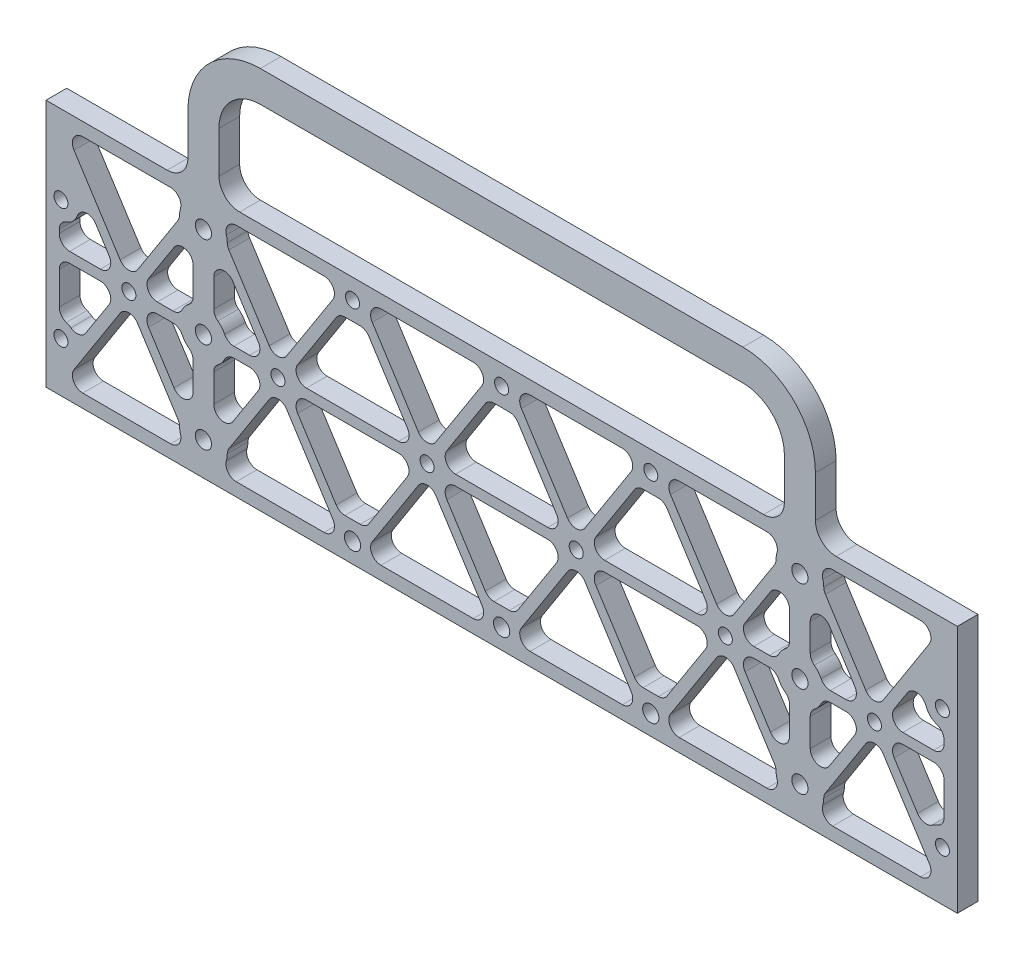
from build123d import *

# Parameters (mm, degrees)
SKETCH1_W              = 279.4
SKETCH1_H              = 76.2
BOSS_EXTRUDE1_DEPTH    = 6.35
F_10_CLEARANCE_HOLE1_D = 4.9784
SKETCH5_W              = 9.525
SKETCH5_H              = 31.75
BOSS_EXTRUDE2_DEPTH    = 6.35
FILLET1_R              = 12.7
FILLET1_OF_MIRROR1_R   = 12.7
FILLET2_R              = 6.35
FILLET3_R              = 6.35
F_8_CLEARANCE_HOLE1_D  = 4.3053
CUT_EXTRUDE1_DEPTH     = 161.800507229
FILLET4_R              = 3.175
FILLET5_R              = 3.175
SKETCH10_R             = 2.15265
SKETCH10_R_2           = 2.4892
CUT_EXTRUDE2_DEPTH     = 161.800507229
FILLET6_R              = 22.225


with BuildPart() as part:
    # Sketch1 → Boss-Extrude1 (new body)
    with BuildSketch(Plane.XY):
        Rectangle(SKETCH1_W, SKETCH1_H)
    extrude(amount=BOSS_EXTRUDE1_DEPTH)

    # #10 Clearance Hole1 (through all)
    with Locations(Plane.XY.offset(6.35)):
        with Locations((-91.44, 27.94), (-91.44, -27.94), (91.44, 27.94), (91.44, -27.94), (-91.44, 0), (91.44, 0)):
            Hole(F_10_CLEARANCE_HOLE1_D / 2)

    # Sketch5 → Boss-Extrude2 (add)
    with BuildSketch(Plane.XY.offset(6.35)):
        with Locations((-91.44, 53.975)):
            Rectangle(SKETCH5_W, SKETCH5_H)
        Polygon((-96.2025, 79.375), (-96.2025, 69.85), (-86.6775, 69.85), (0, 69.85), (0, 79.375), align=None)
    boss_extrude2 = extrude(amount=-BOSS_EXTRUDE2_DEPTH)

    # Fillet1
    fillet1_edges = [part.edges().sort_by_distance(p)[0] for p in [
        (-86.6775, 69.85, 3.175),
    ]]
    fillet(fillet1_edges, radius=FILLET1_R)

    # Mirror1: Boss-Extrude2 across plane
    add(boss_extrude2.mirror(Plane(origin=(0, 0, 0), x_dir=(0, 0, 1), z_dir=(1, 0, 0))))

    # Fillet1 of Mirror1
    fillet1_of_mirror1_edges = [part.edges().sort_by_distance(p)[0] for p in [
        (86.6775, 69.85, 3.175),
    ]]
    fillet(fillet1_of_mirror1_edges, radius=FILLET1_OF_MIRROR1_R)

    # Fillet2
    fillet2_edges = [part.edges().sort_by_distance(p)[0] for p in [
        (-86.6775, 38.1, 3.175),
        (86.6775, 38.1, 3.175),
    ]]
    fillet(fillet2_edges, radius=FILLET2_R)

    # Fillet3
    fillet3_edges = [part.edges().sort_by_distance(p)[0] for p in [
        (-96.2025, 38.1, 3.175),
        (96.2025, 38.1, 3.175),
    ]]
    fillet(fillet3_edges, radius=FILLET3_R)

    # #8 Clearance Hole1 (through all)
    with Locations(Plane.XY.offset(6.35)):
        with Locations((-135.128, 13.97), (-135.128, -22.86), (135.128, 13.97), (135.128, -22.86)):
            Hole(F_8_CLEARANCE_HOLE1_D / 2)

    # Sketch9 → Cut-Extrude1 (cut, through all)
    with BuildSketch(Plane.XY.offset(6.35)):
        with BuildLine():
            Line((-117.204966751, -1.5875), (-135.636, -1.5875))
            Line((-135.636, -1.5875), (-135.636, -17.55662461))
            ThreePointArc((-135.636, -17.55662461), (-132.085038618, -18.486872909), (-129.978664585, -21.493179125))
            Line((-129.978664585, -21.493179125), (-117.204966751, -1.5875))
        make_face()
        with BuildLine():
            Line((-135.636, 8.66662461), (-135.636, 1.5875))
            Line((-135.636, 1.5875), (-117.204966751, 1.5875))
            Line((-117.204966751, 1.5875), (-124.437036119, 12.857474766))
            ThreePointArc((-124.437036119, 12.857474766), (-127.475945101, 14.296480554), (-130.10350516, 12.198473503))
            ThreePointArc((-130.10350516, 12.198473503), (-132.261264826, 9.479378221), (-135.636, 8.66662461))
        make_face()
        with BuildLine():
            ThreePointArc((-98.719572426, 27.218906156), (-98.048472928, 31.076915141), (-95.483628944, 34.036))
            Line((-95.483628944, 34.036), (-128.445099748, 34.036))
            ThreePointArc((-128.445099748, 34.036), (-131.23121879, 32.383552359), (-131.117233367, 29.146261849))
            Line((-131.117233367, 29.146261849), (-114.3, 2.93940652))
            Line((-114.3, 2.93940652), (-98.719572426, 27.218906156))
        make_face()
        with BuildLine():
            Line((-48.624966751, 34.036), (-87.396371056, 34.036))
            ThreePointArc((-87.396371056, 34.036), (-84.831527072, 31.076915141), (-84.160427574, 27.218906156))
            Line((-84.160427574, 27.218906156), (-68.58, 2.93940652))
            Line((-68.58, 2.93940652), (-48.624966751, 34.036))
        make_face()
        with BuildLine():
            ThreePointArc((-94.615, 16.909863774), (-96.89652343, 19.95655454), (-100.462133618, 18.624601925))
            Line((-100.462133618, 18.624601925), (-111.395033249, 1.5875))
            Line((-111.395033249, 1.5875), (-98.58086793, 1.5875))
            ThreePointArc((-98.58086793, 1.5875), (-97.172467578, 4.54433345), (-94.615, 6.590259937))
            Line((-94.615, 6.590259937), (-94.615, 16.909863774))
        make_face()
        with BuildLine():
            ThreePointArc((-82.417866382, 18.624601925), (-85.98347657, 19.95655454), (-88.265, 16.909863774))
            Line((-88.265, 16.909863774), (-88.265, 6.590259937))
            ThreePointArc((-88.265, 6.590259937), (-85.707532422, 4.54433345), (-84.29913207, 1.5875))
            Line((-84.29913207, 1.5875), (-71.484966751, 1.5875))
            Line((-71.484966751, 1.5875), (-82.417866382, 18.624601925))
        make_face()
        with BuildLine():
            ThreePointArc((-94.615, -6.590259937), (-97.172467578, -4.54433345), (-98.58086793, -1.5875))
            Line((-98.58086793, -1.5875), (-111.395033249, -1.5875))
            Line((-111.395033249, -1.5875), (-100.462133618, -18.624601925))
            ThreePointArc((-100.462133618, -18.624601925), (-96.89652343, -19.95655454), (-94.615, -16.909863774))
            Line((-94.615, -16.909863774), (-94.615, -6.590259937))
        make_face()
        with BuildLine():
            ThreePointArc((-84.29913207, -1.5875), (-85.707532422, -4.54433345), (-88.265, -6.590259937))
            Line((-88.265, -6.590259937), (-88.265, -16.909863774))
            ThreePointArc((-88.265, -16.909863774), (-85.98347657, -19.95655454), (-82.417866382, -18.624601925))
            Line((-82.417866382, -18.624601925), (-71.484966751, -1.5875))
            Line((-71.484966751, -1.5875), (-84.29913207, -1.5875))
        make_face()
        with BuildLine():
            ThreePointArc((-95.483628944, -34.036), (-98.048472928, -31.076915141), (-98.719572426, -27.218906156))
            Line((-98.719572426, -27.218906156), (-114.3, -2.93940652))
            Line((-114.3, -2.93940652), (-131.117233367, -29.146261849))
            ThreePointArc((-131.117233367, -29.146261849), (-131.23121879, -32.383552359), (-128.445099748, -34.036))
            Line((-128.445099748, -34.036), (-95.483628944, -34.036))
        make_face()
        with BuildLine():
            ThreePointArc((-84.160427574, -27.218906156), (-84.831527072, -31.076915141), (-87.396371056, -34.036))
            Line((-87.396371056, -34.036), (-48.624966751, -34.036))
            Line((-48.624966751, -34.036), (-68.58, -2.93940652))
            Line((-68.58, -2.93940652), (-84.160427574, -27.218906156))
        make_face()
        Polygon((-41.648795628, 26.3398), (-49.791204372, 26.3398), (-65.675033249, 1.5875), (-25.764966751, 1.5875), align=None)
        Polygon((-22.86, 2.93940652), (-2.904966751, 34.036), (-42.815033249, 34.036), align=None)
        Polygon((4.071204372, 26.3398), (-4.071204372, 26.3398), (-19.955033249, 1.5875), (19.955033249, 1.5875), align=None)
        Polygon((22.86, 2.93940652), (42.815033249, 34.036), (2.904966751, 34.036), align=None)
        Polygon((49.791204372, 26.3398), (41.648795628, 26.3398), (25.764966751, 1.5875), (65.675033249, 1.5875), align=None)
        with BuildLine():
            ThreePointArc((84.160427574, 27.218906156), (84.831527072, 31.076915141), (87.396371056, 34.036))
            Line((87.396371056, 34.036), (48.624966751, 34.036))
            Line((48.624966751, 34.036), (68.58, 2.93940652))
            Line((68.58, 2.93940652), (84.160427574, 27.218906156))
        make_face()
        with BuildLine():
            Line((128.445099748, 34.036), (95.483628944, 34.036))
            ThreePointArc((95.483628944, 34.036), (98.048472928, 31.076915141), (98.719572426, 27.218906156))
            Line((98.719572426, 27.218906156), (114.3, 2.93940652))
            Line((114.3, 2.93940652), (131.117233367, 29.146261849))
            ThreePointArc((131.117233367, 29.146261849), (131.23121879, 32.383552359), (128.445099748, 34.036))
        make_face()
        with BuildLine():
            ThreePointArc((88.265, 16.909863774), (85.98347657, 19.95655454), (82.417866382, 18.624601925))
            Line((82.417866382, 18.624601925), (71.484966751, 1.5875))
            Line((71.484966751, 1.5875), (84.29913207, 1.5875))
            ThreePointArc((84.29913207, 1.5875), (85.707532422, 4.54433345), (88.265, 6.590259937))
            Line((88.265, 6.590259937), (88.265, 16.909863774))
        make_face()
        with BuildLine():
            ThreePointArc((100.462133618, 18.624601925), (96.89652343, 19.95655454), (94.615, 16.909863774))
            Line((94.615, 16.909863774), (94.615, 6.590259937))
            ThreePointArc((94.615, 6.590259937), (97.172467578, 4.54433345), (98.58086793, 1.5875))
            Line((98.58086793, 1.5875), (111.395033249, 1.5875))
            Line((111.395033249, 1.5875), (100.462133618, 18.624601925))
        make_face()
        with BuildLine():
            ThreePointArc((88.265, -6.590259937), (85.707532422, -4.54433345), (84.29913207, -1.5875))
            Line((84.29913207, -1.5875), (71.484966751, -1.5875))
            Line((71.484966751, -1.5875), (82.417866382, -18.624601925))
            ThreePointArc((82.417866382, -18.624601925), (85.98347657, -19.95655454), (88.265, -16.909863774))
            Line((88.265, -16.909863774), (88.265, -6.590259937))
        make_face()
        with BuildLine():
            ThreePointArc((98.58086793, -1.5875), (97.172467578, -4.54433345), (94.615, -6.590259937))
            Line((94.615, -6.590259937), (94.615, -16.909863774))
            ThreePointArc((94.615, -16.909863774), (96.89652343, -19.95655454), (100.462133618, -18.624601925))
            Line((100.462133618, -18.624601925), (111.395033249, -1.5875))
            Line((111.395033249, -1.5875), (98.58086793, -1.5875))
        make_face()
        with BuildLine():
            ThreePointArc((87.396371056, -34.036), (84.831527072, -31.076915141), (84.160427574, -27.218906156))
            Line((84.160427574, -27.218906156), (68.58, -2.93940652))
            Line((68.58, -2.93940652), (48.624966751, -34.036))
            Line((48.624966751, -34.036), (87.396371056, -34.036))
        make_face()
        with BuildLine():
            ThreePointArc((98.719572426, -27.218906156), (98.048472928, -31.076915141), (95.483628944, -34.036))
            Line((95.483628944, -34.036), (134.255033249, -34.036))
            Line((134.255033249, -34.036), (114.3, -2.93940652))
            Line((114.3, -2.93940652), (98.719572426, -27.218906156))
        make_face()
        with BuildLine():
            ThreePointArc((130.10350516, 12.198473503), (127.475945101, 14.296480554), (124.437036119, 12.857474766))
            Line((124.437036119, 12.857474766), (117.204966751, 1.5875))
            Line((117.204966751, 1.5875), (135.636, 1.5875))
            Line((135.636, 1.5875), (135.636, 8.66662461))
            ThreePointArc((135.636, 8.66662461), (132.261264826, 9.479378221), (130.10350516, 12.198473503))
        make_face()
        with BuildLine():
            Line((135.636, -17.55662461), (135.636, -1.5875))
            Line((135.636, -1.5875), (117.204966751, -1.5875))
            Line((117.204966751, -1.5875), (129.978664585, -21.493179125))
            ThreePointArc((129.978664585, -21.493179125), (132.085038618, -18.486872909), (135.636, -17.55662461))
        make_face()
        Polygon((65.675033249, -1.5875), (25.764966751, -1.5875), (41.648795628, -26.3398), (49.791204372, -26.3398), align=None)
        Polygon((42.815033249, -34.036), (22.86, -2.93940652), (2.904966751, -34.036), align=None)
        Polygon((19.955033249, -1.5875), (-19.955033249, -1.5875), (-4.071204372, -26.3398), (4.071204372, -26.3398), align=None)
        Polygon((-2.904966751, -34.036), (-22.86, -2.93940652), (-42.815033249, -34.036), align=None)
        Polygon((-25.764966751, -1.5875), (-65.675033249, -1.5875), (-49.791204372, -26.3398), (-41.648795628, -26.3398), align=None)
    extrude(amount=-CUT_EXTRUDE1_DEPTH, mode=Mode.SUBTRACT)

    # Fillet4
    fillet4_edges = [part.edges().sort_by_distance(p)[0] for p in [
        (41.648795628, 26.3398, 3.175),
        (49.791204372, 26.3398, 3.175),
        (65.675033249, 1.5875, 3.175),
        (25.764966751, 1.5875, 3.175),
        (41.648795628, -26.3398, 3.175),
        (25.764966751, -1.5875, 3.175),
        (65.675033249, -1.5875, 3.175),
        (49.791204372, -26.3398, 3.175),
        (22.86, 2.93940652, 3.175),
        (2.904966751, 34.036, 3.175),
        (42.815033249, 34.036, 3.175),
        (42.815033249, -34.036, 3.175),
        (2.904966751, -34.036, 3.175),
        (22.86, -2.93940652, 3.175),
        (95.483628944, -34.036, 3.175),
        (98.719572426, -27.218906156, 3.175),
        (114.3, -2.93940652, 3.175),
        (134.255033249, -34.036, 3.175),
        (87.396371056, 34.036, 3.175),
        (84.160427574, 27.218906156, 3.175),
        (68.58, 2.93940652, 3.175),
        (48.624966751, 34.036, 3.175),
        (84.160427574, -27.218906156, 3.175),
        (87.396371056, -34.036, 3.175),
        (48.624966751, -34.036, 3.175),
        (68.58, -2.93940652, 3.175),
        (-4.071204372, -26.3398, 3.175),
        (-19.955033249, -1.5875, 3.175),
        (19.955033249, -1.5875, 3.175),
        (4.071204372, -26.3398, 3.175),
        (-49.791204372, -26.3398, 3.175),
        (-65.675033249, -1.5875, 3.175),
        (-25.764966751, -1.5875, 3.175),
        (-41.648795628, -26.3398, 3.175),
        (-49.791204372, 26.3398, 3.175),
        (-41.648795628, 26.3398, 3.175),
        (-25.764966751, 1.5875, 3.175),
        (-65.675033249, 1.5875, 3.175),
        (-2.904966751, -34.036, 3.175),
        (-42.815033249, -34.036, 3.175),
        (-22.86, -2.93940652, 3.175),
        (-22.86, 2.93940652, 3.175),
        (-42.815033249, 34.036, 3.175),
        (-2.904966751, 34.036, 3.175),
        (-87.396371056, -34.036, 3.175),
        (-84.160427574, -27.218906156, 3.175),
        (-68.58, -2.93940652, 3.175),
        (-48.624966751, -34.036, 3.175),
        (-84.160427574, 27.218906156, 3.175),
        (-87.396371056, 34.036, 3.175),
        (-48.624966751, 34.036, 3.175),
        (-68.58, 2.93940652, 3.175),
        (-95.483628944, 34.036, 3.175),
        (-98.719572426, 27.218906156, 3.175),
        (-114.3, 2.93940652, 3.175),
        (-114.3, -2.93940652, 3.175),
        (-98.719572426, -27.218906156, 3.175),
        (-95.483628944, -34.036, 3.175),
        (-98.58086793, 1.5875, 3.175),
        (-111.395033249, 1.5875, 3.175),
        (71.484966751, -1.5875, 3.175),
        (111.395033249, 1.5875, 3.175),
        (98.58086793, 1.5875, 3.175),
        (84.29913207, 1.5875, 3.175),
        (71.484966751, 1.5875, 3.175),
        (98.719572426, 27.218906156, 3.175),
        (95.483628944, 34.036, 3.175),
        (114.3, 2.93940652, 3.175),
        (-117.204966751, 1.5875, 3.175),
        (-135.636, 1.5875, 3.175),
        (-135.636, 8.66662461, 3.175),
        (-129.978664585, -21.493179125, 3.175),
        (-135.636, -17.55662461, 3.175),
        (-135.636, -1.5875, 3.175),
        (-117.204966751, -1.5875, 3.175),
        (135.636, -17.55662461, 3.175),
        (129.978664585, -21.493179125, 3.175),
        (117.204966751, -1.5875, 3.175),
        (135.636, -1.5875, 3.175),
        (-71.484966751, 1.5875, 3.175),
        (-84.29913207, 1.5875, 3.175),
        (-71.484966751, -1.5875, 3.175),
        (-111.395033249, -1.5875, 3.175),
        (135.636, 8.66662461, 3.175),
        (135.636, 1.5875, 3.175),
        (117.204966751, 1.5875, 3.175),
        (-4.071204372, 26.3398, 3.175),
        (4.071204372, 26.3398, 3.175),
        (19.955033249, 1.5875, 3.175),
        (-19.955033249, 1.5875, 3.175),
    ]]
    fillet(fillet4_edges, radius=FILLET4_R)

    # Fillet5
    fillet5_edges = [part.edges().sort_by_distance(p)[0] for p in [
        (-94.615, 6.590259937, 3.175),
        (84.29913207, -1.5875, 3.175),
        (88.265, -6.590259937, 3.175),
        (94.615, -6.590259937, 3.175),
        (98.58086793, -1.5875, 3.175),
        (111.395033249, -1.5875, 3.175),
        (94.615, 6.590259937, 3.175),
        (88.265, 6.590259937, 3.175),
        (-88.265, 6.590259937, 3.175),
        (-88.265, -6.590259937, 3.175),
        (-84.29913207, -1.5875, 3.175),
        (-98.58086793, -1.5875, 3.175),
        (-94.615, -6.590259937, 3.175),
    ]]
    fillet(fillet5_edges, radius=FILLET5_R)

    # Sketch10 → Cut-Extrude2 (cut, through all)
    with BuildSketch(Plane.XY.offset(6.35)):
        with Locations((-114.3, 0)):
            Circle(SKETCH10_R)
        with Locations((-68.58, 0)):
            Circle(SKETCH10_R)
        with Locations((-22.86, 0)):
            Circle(SKETCH10_R)
        with Locations((22.86, 0)):
            Circle(SKETCH10_R)
        with Locations((68.58, 0)):
            Circle(SKETCH10_R)
        with Locations((114.3, 0)):
            Circle(SKETCH10_R)
        with Locations((-45.72, 32.004)):
            Circle(SKETCH10_R)
        with Locations((-45.72, -32.004)):
            Circle(SKETCH10_R_2)
        with Locations((0, 32.004)):
            Circle(SKETCH10_R)
        with Locations((45.72, 32.004)):
            Circle(SKETCH10_R)
        with Locations((0, -32.004)):
            Circle(SKETCH10_R_2)
        with Locations((45.72, -32.004)):
            Circle(SKETCH10_R_2)
    extrude(amount=-CUT_EXTRUDE2_DEPTH, mode=Mode.SUBTRACT)

    # Fillet6
    fillet6_edges = [part.edges().sort_by_distance(p)[0] for p in [
        (-96.2025, 79.375, 3.175),
        (96.2025, 79.375, 3.175),
    ]]
    fillet(fillet6_edges, radius=FILLET6_R)


solid = part.part
